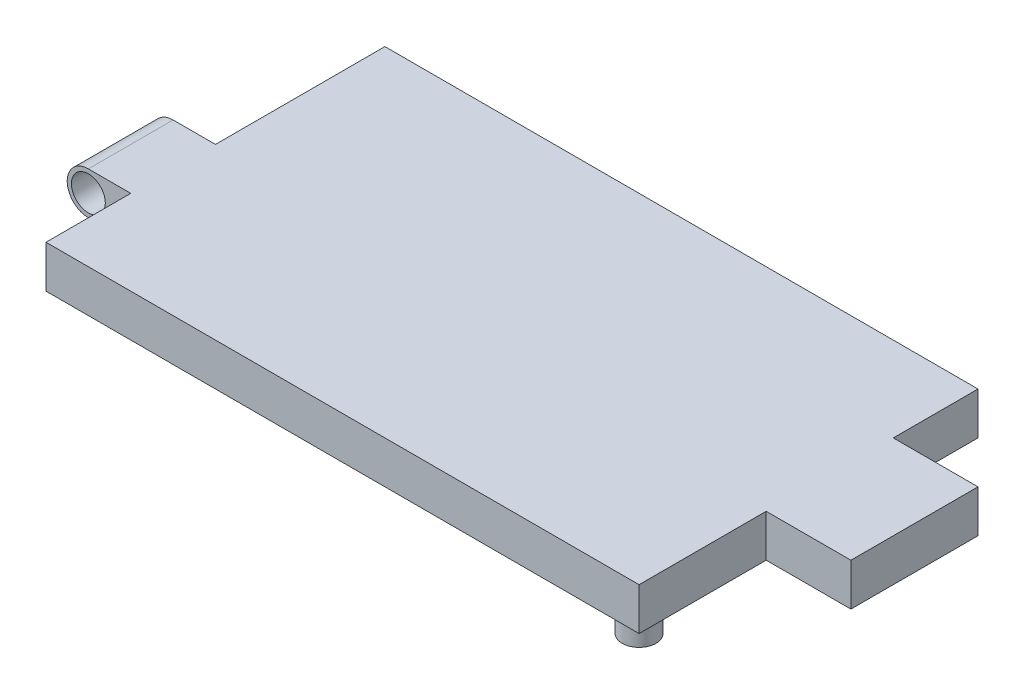
from build123d import *

# Parameters (mm, degrees)
BASE_DEPTH          = 5
BASE_DEPTH_BACK     = 5
ESQUISSE1_R         = 2
ESQUISSE2_W         = 75
ESQUISSE2_H         = 5
BOSS_GRAND_DEPTH    = 10
ESQUISSE3_W         = 75
ESQUISSE3_H         = 5
BOSS_PETIT_DEPTH    = 10
ESQUISSE4_W         = 5
ESQUISSE4_H         = 15
BOSS_BLOQUER_DEPTH  = 5
ESQUISSE5_W         = 5
ESQUISSE5_H         = 15
VIDE_BLOQUER_DEPTH  = 5
ESQUISSE6_W         = 70
ESQUISSE6_H         = 5
BOSS_BAS_DEPTH      = 10
ESQUISSE8_R         = 2
ATTACHE_CORDE_DEPTH = 5


with BuildPart() as part:
    # Esquisse1 → BASE (new, two sides: drawn at the far end of the back side and taken through both)
    with BuildSketch(Plane.XY.offset(-BASE_DEPTH_BACK)):
        with BuildLine():
            Line((-80, 2.5), (0, 2.5))
            Line((0, 2.5), (0, -2.5))
            Line((0, -2.5), (-80, -2.5))
            ThreePointArc((-80, -2.5), (-82.5, 0), (-80, 2.5))
        make_face()
        with Locations((-80, 0)):
            Circle(ESQUISSE1_R, mode=Mode.SUBTRACT)
    extrude(amount=BASE_DEPTH + BASE_DEPTH_BACK)

    # Esquisse2 → BOSS GRAND (add)
    with BuildSketch(Plane.XY.offset(5)):
        with Locations((-37.5, 0)):
            Rectangle(ESQUISSE2_W, ESQUISSE2_H)
    extrude(amount=BOSS_GRAND_DEPTH)

    # Esquisse3 → BOSS PETIT (add)
    with BuildSketch(Plane(origin=(0, 0, -5), x_dir=(-1, 0, 0), z_dir=(0, 0, -1))):
        with Locations((37.5, 0)):
            Rectangle(ESQUISSE3_W, ESQUISSE3_H)
    extrude(amount=BOSS_PETIT_DEPTH)

    # Esquisse4 → BOSS BLOQUER (add)
    with BuildSketch(Plane(origin=(0, 2.5, 0), x_dir=(1, 0, 0), z_dir=(0, 1, 0))):
        with Locations((2.5, 7.5)):
            Rectangle(ESQUISSE4_W, ESQUISSE4_H)
    extrude(amount=-BOSS_BLOQUER_DEPTH)

    # Esquisse5 → VIDE BLOQUER (cut)
    with BuildSketch(Plane(origin=(0, 2.5, 0), x_dir=(1, 0, 0), z_dir=(0, 1, 0))):
        with Locations((-2.5, -7.5)):
            Rectangle(ESQUISSE5_W, ESQUISSE5_H)
    extrude(amount=-VIDE_BLOQUER_DEPTH, mode=Mode.SUBTRACT)

    # Esquisse6 → BOSS BAS (add)
    with BuildSketch(Plane(origin=(0, 0, -15), x_dir=(-1, 0, 0), z_dir=(0, 0, -1))):
        with Locations((40, 0)):
            Rectangle(ESQUISSE6_W, ESQUISSE6_H)
    extrude(amount=BOSS_BAS_DEPTH)

    # Esquisse8 → ATTACHE CORDE (add)
    with BuildSketch(Plane.XZ.offset(2.5)):
        with Locations((-10, 10)):
            Circle(ESQUISSE8_R)
    extrude(amount=ATTACHE_CORDE_DEPTH)


solid = part.part
